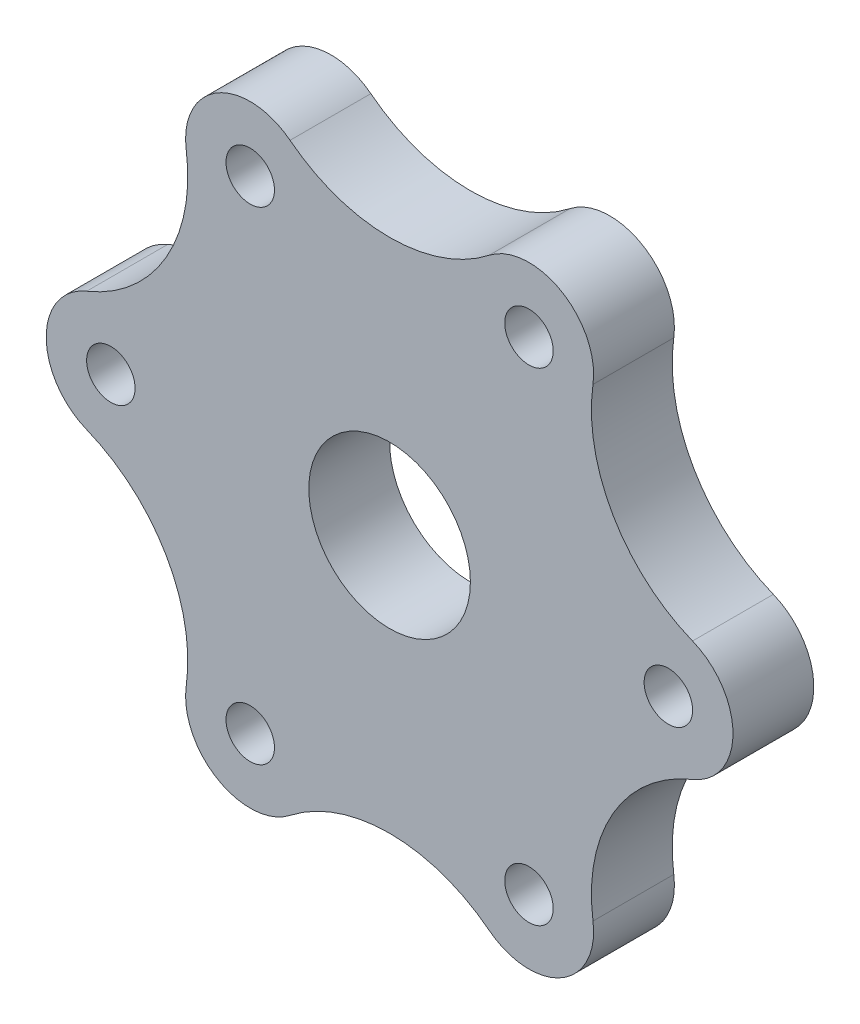
from build123d import *

# Parameters (mm, degrees)
SKETCH2_R           = 10
SKETCH2_R_2         = 3
BOSS_EXTRUDE1_DEPTH = 5


with BuildPart() as part:
    # Sketch2 → Boss-Extrude1 (new, symmetric)
    with BuildSketch(Plane.XY):
        with BuildLine():
            ThreePointArc((-37.492992706, 7.419029226), (-42.5, 0), (-37.492992706, -7.419029226))
            ThreePointArc((-37.492992706, -7.419029226), (-27.654966395, -15.966602292), (-25.171564134, -28.760369534))
            ThreePointArc((-25.171564134, -28.760369534), (-21.25, -36.806079661), (-12.321428571, -36.17939876))
            ThreePointArc((-12.321428571, -36.17939876), (0, -31.933204585), (12.321428571, -36.17939876))
            ThreePointArc((12.321428571, -36.17939876), (21.25, -36.806079661), (25.171564134, -28.760369534))
            ThreePointArc((25.171564134, -28.760369534), (27.654966395, -15.966602293), (37.492992706, -7.419029226))
            ThreePointArc((37.492992706, -7.419029226), (42.5, 0), (37.492992706, 7.419029226))
            ThreePointArc((37.492992706, 7.419029226), (27.654966395, 15.966602293), (25.171564134, 28.760369534))
            ThreePointArc((25.171564134, 28.760369534), (21.25, 36.806079661), (12.321428571, 36.17939876))
            ThreePointArc((12.321428571, 36.17939876), (0, 31.933204585), (-12.321428571, 36.17939876))
            ThreePointArc((-12.321428571, 36.17939876), (-21.25, 36.806079661), (-25.171564134, 28.760369534))
            ThreePointArc((-25.171564134, 28.760369534), (-27.654966395, 15.966602293), (-37.492992706, 7.419029226))
        make_face()
        Circle(SKETCH2_R, mode=Mode.SUBTRACT)
        with Locations((-34.5, 0)):
            Circle(SKETCH2_R_2, mode=Mode.SUBTRACT)
        with Locations((-17.25, 29.877876431)):
            Circle(SKETCH2_R_2, mode=Mode.SUBTRACT)
        with Locations((17.25, 29.877876431)):
            Circle(SKETCH2_R_2, mode=Mode.SUBTRACT)
        with Locations((34.5, 0)):
            Circle(SKETCH2_R_2, mode=Mode.SUBTRACT)
        with Locations((17.25, -29.877876431)):
            Circle(SKETCH2_R_2, mode=Mode.SUBTRACT)
        with Locations((-17.25, -29.877876431)):
            Circle(SKETCH2_R_2, mode=Mode.SUBTRACT)
    extrude(amount=BOSS_EXTRUDE1_DEPTH, both=True)


solid = part.part
